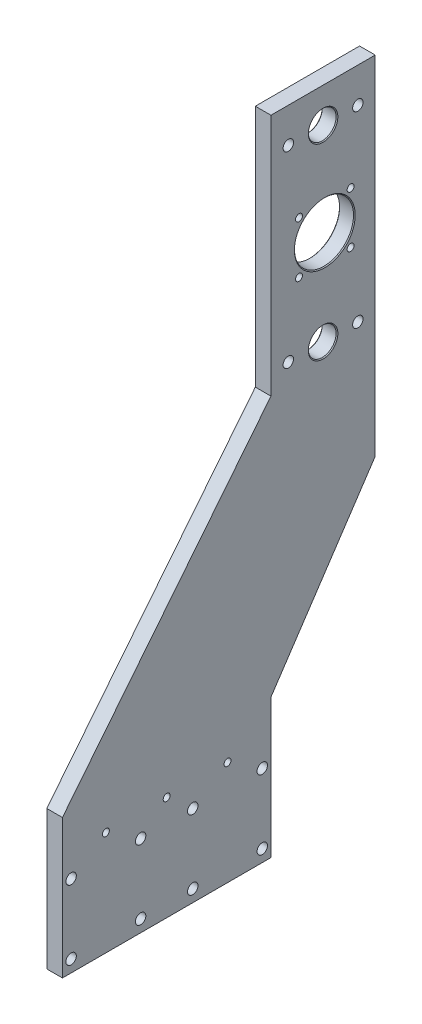
from build123d import *

# Parameters (mm, degrees)
SALIENTE_EXTRUIR1_DEPTH = 4.5
CROQUIS4_R              = 17
CROQUIS4_R_2            = 2
CORTAR_EXTRUIR3_DEPTH   = 599.217436148
CHAFL_N1_SIZE           = 0.5
CROQUIS5_R              = 8
CROQUIS5_R_2            = 3
CORTAR_EXTRUIR4_DEPTH   = 599.217436148
CHAFL_N2_SIZE           = 0.5
CROQUIS3_R              = 3
CORTAR_EXTRUIR2_DEPTH   = 599.217436148
CHAFL_N3_SIZE           = 0.5
CROQUIS2_R              = 2
CORTAR_EXTRUIR1_DEPTH   = 599.217436148
CHAFL_N4_SIZE           = 0.5


with BuildPart() as part:
    # Croquis1 → Saliente-Extruir1 (new, symmetric)
    with BuildSketch(Plane(origin=(0, 0, 0), x_dir=(0, 0, -1), z_dir=(1, 0, 0))):
        Polygon((-294.796624044, -440.459461787), (-174.796624044, -290.459461787), (-174.796624044, -150.459461787), (-114.796624044, -150.459461787), (-114.796624044, -350.459461787), (-174.796624044, -440.459461787), (-174.796624044, -520.459461787), (-294.796624044, -520.459461787), align=None)
    extrude(amount=SALIENTE_EXTRUIR1_DEPTH, both=True)

    # Croquis4 → Cortar-Extruir3 (cut, through all)
    with BuildSketch(Plane(origin=(4.5, 0, 0), x_dir=(0, 0, -1), z_dir=(1, 0, 0))):
        with Locations((-143.796624044, -224.459461787)):
            Circle(CROQUIS4_R)
        with Locations((-158.645866449, -209.610219382)):
            Circle(CROQUIS4_R_2)
        with Locations((-128.947381639, -209.610219382)):
            Circle(CROQUIS4_R_2)
        with Locations((-128.947381639, -239.308704192)):
            Circle(CROQUIS4_R_2)
        with Locations((-158.645866449, -239.308704192)):
            Circle(CROQUIS4_R_2)
    extrude(amount=-CORTAR_EXTRUIR3_DEPTH, mode=Mode.SUBTRACT)

    # Chaflán1
    chafl_n1_edges = [part.edges().sort_by_distance(p)[0] for p in [
        (-4.5, -209.610219382, 160.645866449),
        (-4.5, -224.459461787, 160.796624044),
        (4.5, -224.459461787, 160.796624044),
        (-4.5, -209.610219382, 130.947381639),
        (-4.5, -239.308704192, 130.947381639),
        (-4.5, -239.308704192, 160.645866449),
    ]]
    chamfer(chafl_n1_edges, length=CHAFL_N1_SIZE)

    # Croquis5 → Cortar-Extruir4 (cut, through all)
    with BuildSketch(Plane(origin=(4.5, 0, 0), x_dir=(0, 0, -1), z_dir=(1, 0, 0))):
        with Locations((-144.796624044, -170.459461787)):
            Circle(CROQUIS5_R)
        with Locations((-144.796624044, -278.459461787)):
            Circle(CROQUIS5_R)
        with Locations((-124.796624044, -170.459461787)):
            Circle(CROQUIS5_R_2)
        with Locations((-164.796624044, -170.459461787)):
            Circle(CROQUIS5_R_2)
        with Locations((-164.796624044, -278.459461787)):
            Circle(CROQUIS5_R_2)
        with Locations((-124.796624044, -278.459461787)):
            Circle(CROQUIS5_R_2)
    extrude(amount=-CORTAR_EXTRUIR4_DEPTH, mode=Mode.SUBTRACT)

    # Chaflán2
    chafl_n2_edges = [part.edges().sort_by_distance(p)[0] for p in [
        (-4.5, -170.459461787, 152.796624044),
        (4.5, -170.459461787, 152.796624044),
        (-4.5, -278.459461787, 152.796624044),
        (4.5, -278.459461787, 152.796624044),
        (-4.5, -170.459461787, 127.796624044),
        (-4.5, -170.459461787, 167.796624044),
        (-4.5, -278.459461787, 167.796624044),
        (-4.5, -278.459461787, 127.796624044),
    ]]
    chamfer(chafl_n2_edges, length=CHAFL_N2_SIZE)

    # Croquis3 → Cortar-Extruir2 (cut, through all)
    with BuildSketch(Plane(origin=(4.5, 0, 0), x_dir=(0, 0, -1), z_dir=(1, 0, 0))):
        with Locations((-289.796624044, -473.459461787)):
            Circle(CROQUIS3_R)
        with Locations((-289.796624044, -513.459461787)):
            Circle(CROQUIS3_R)
        with Locations((-249.796624044, -473.459461787)):
            Circle(CROQUIS3_R)
        with Locations((-249.796624044, -513.459461787)):
            Circle(CROQUIS3_R)
        with Locations(Location((-219.796624044, -513.459461787, 0), (0, 0, 180))):
            Circle(CROQUIS3_R)
        with Locations(Location((-219.796624044, -473.459461787, 0), (0, 0, 180))):
            Circle(CROQUIS3_R)
        with Locations(Location((-179.796624044, -513.459461787, 0), (0, 0, 180))):
            Circle(CROQUIS3_R)
        with Locations(Location((-179.796624044, -473.459461787, 0), (0, 0, 180))):
            Circle(CROQUIS3_R)
    extrude(amount=-CORTAR_EXTRUIR2_DEPTH, mode=Mode.SUBTRACT)

    # Chaflán3
    chafl_n3_edges = [part.edges().sort_by_distance(p)[0] for p in [
        (-4.5, -473.459461787, 292.796624044),
        (-4.5, -513.459461787, 292.796624044),
        (-4.5, -473.459461787, 252.796624044),
        (-4.5, -513.459461787, 252.796624044),
        (-4.5, -513.459461787, 216.796624044),
        (-4.5, -473.459461787, 216.796624044),
        (-4.5, -513.459461787, 176.796624044),
        (-4.5, -473.459461787, 176.796624044),
    ]]
    chamfer(chafl_n3_edges, length=CHAFL_N3_SIZE)

    # Croquis2 → Cortar-Extruir1 (cut, through all)
    with BuildSketch(Plane(origin=(4.5, 0, 0), x_dir=(0, 0, -1), z_dir=(1, 0, 0))):
        with Locations((-234.796624044, -460.459461787)):
            Circle(CROQUIS2_R)
        with Locations((-269.796624044, -460.459461787)):
            Circle(CROQUIS2_R)
        with Locations((-199.796624044, -460.459461787)):
            Circle(CROQUIS2_R)
    extrude(amount=-CORTAR_EXTRUIR1_DEPTH, mode=Mode.SUBTRACT)

    # Chaflán4
    chafl_n4_edges = [part.edges().sort_by_distance(p)[0] for p in [
        (-4.5, -460.459461787, 236.796624044),
        (-4.5, -460.459461787, 271.796624044),
        (-4.5, -460.459461787, 201.796624044),
    ]]
    chamfer(chafl_n4_edges, length=CHAFL_N4_SIZE)


solid = part.part
